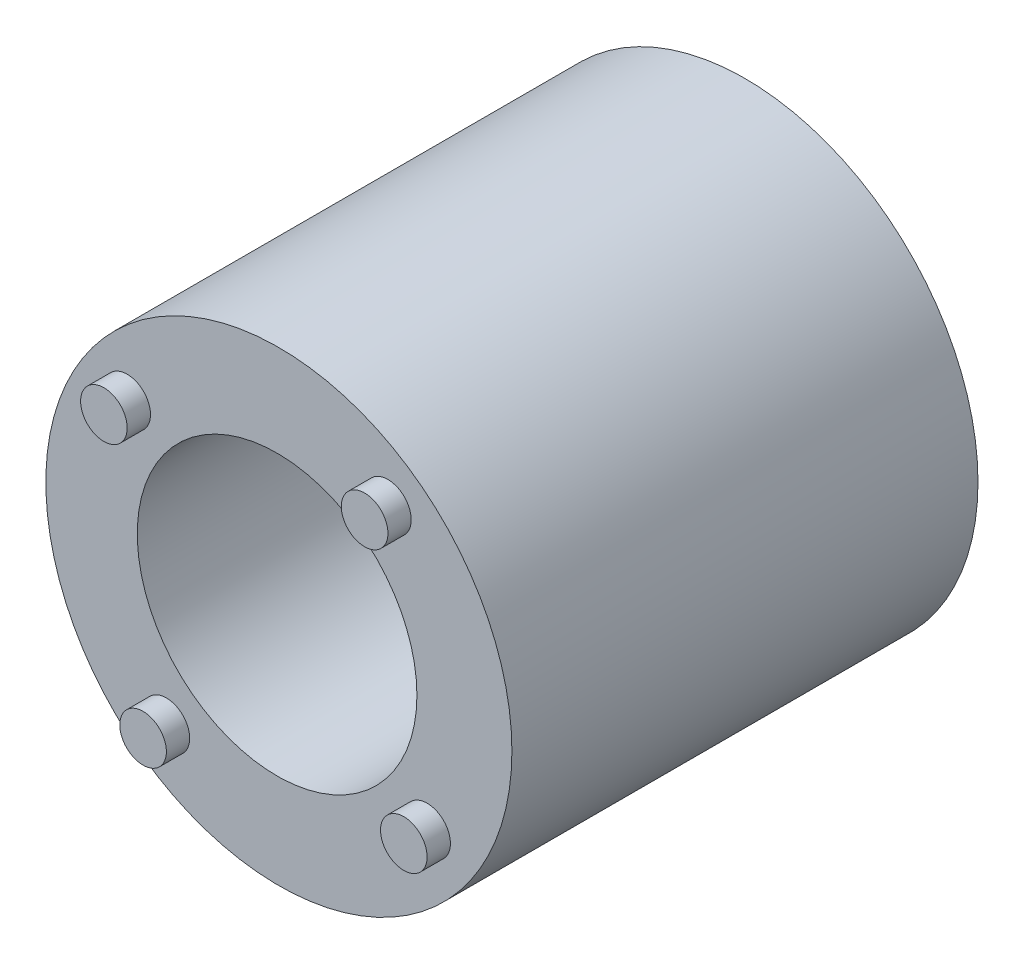
from build123d import *

# Parameters (mm, degrees)
SKETCH1_R           = 50
BOSS_EXTRUDE1_DEPTH = 100
SKETCH3_R           = 5
BOSS_EXTRUDE3_DEPTH = 5
SKETCH4_R           = 5
BOSS_EXTRUDE4_DEPTH = 5
SKETCH5_R           = 30
CUT_EXTRUDE1_DEPTH  = 127.736251111


with BuildPart() as part:
    # Sketch1 → Boss-Extrude1 (new body)
    with BuildSketch(Plane.XY):
        with Locations((0.369408828, 0)):
            Circle(SKETCH1_R)
    extrude(amount=BOSS_EXTRUDE1_DEPTH)

    # Sketch3 → Boss-Extrude3 (add)
    with BuildSketch(Plane(origin=(0, 0, 0), x_dir=(-1, 0, 0), z_dir=(0, 0, -1))):
        with Locations(Location((0, 35, 0), (0, 0, 180))):
            Circle(SKETCH3_R)
        with Locations(Location((35, 0, 0), (0, 0, 180))):
            Circle(SKETCH3_R)
        with Locations(Location((0, -35, 0), (0, 0, 180))):
            Circle(SKETCH3_R)
        with Locations(Location((-35, 0, 0), (0, 0, 180))):
            Circle(SKETCH3_R)
    extrude(amount=BOSS_EXTRUDE3_DEPTH)

    # Sketch4 → Boss-Extrude4 (add)
    with BuildSketch(Plane.XY.offset(100)):
        with Locations((23.764833651, 32.175031958)):
            Circle(SKETCH4_R)
        with Locations((32.175031958, -23.764833651)):
            Circle(SKETCH4_R)
        with Locations((-23.764833651, -32.175031958)):
            Circle(SKETCH4_R)
        with Locations((-32.175031958, 23.764833651)):
            Circle(SKETCH4_R)
    extrude(amount=BOSS_EXTRUDE4_DEPTH)

    # Sketch5 → Cut-Extrude1 (cut, through all)
    with BuildSketch(Plane.XY.offset(100)):
        with Locations((-0.009474688, 0.189441758)):
            Circle(SKETCH5_R)
    extrude(amount=-CUT_EXTRUDE1_DEPTH, mode=Mode.SUBTRACT)


solid = part.part
